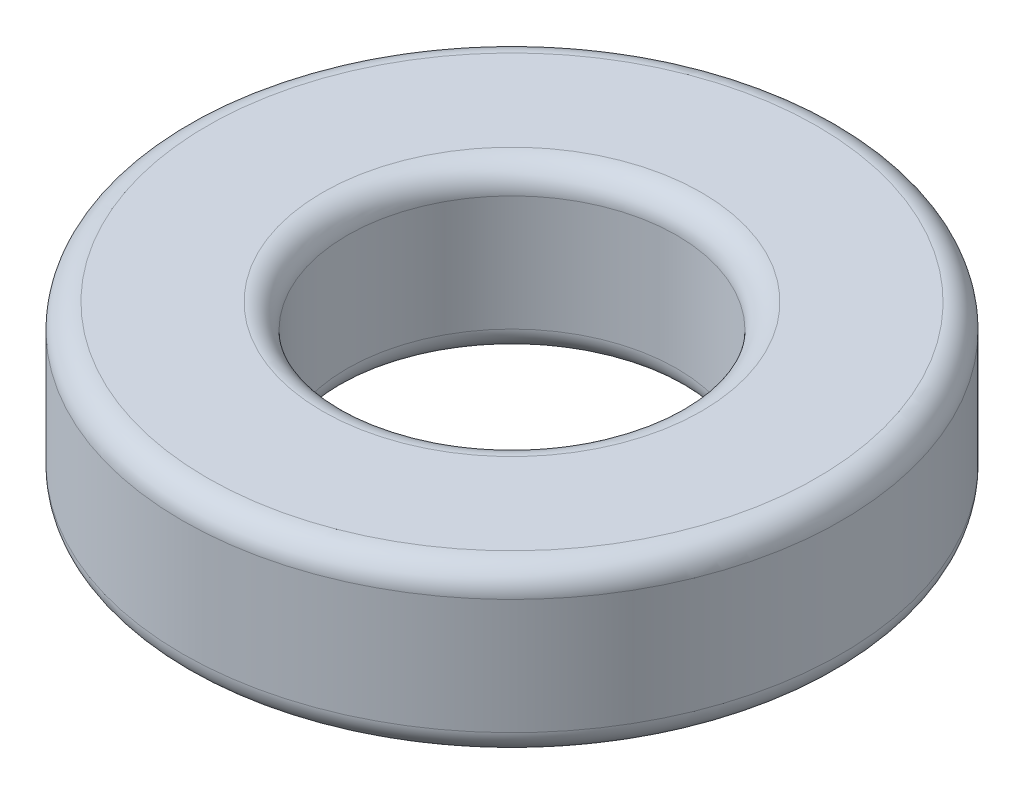
from build123d import *

# Parameters (mm, degrees)
SKETCH2_R           = 50.8
BOSS_EXTRUDE3_DEPTH = 12.7
SKETCH4_R           = 25.4
CUT_EXTRUDE1_DEPTH  = 13.97
FILLET1_R           = 3.81
FILLET2_R           = 3.81
FILLET3_R           = 3.81
FILLET4_R           = 3.81


with BuildPart() as part:
    # Sketch2 → Boss-Extrude3 (new, symmetric)
    with BuildSketch(Plane(origin=(0, 0, 0), x_dir=(1, 0, 0), z_dir=(0, 1, 0))):
        with Locations(Location((0, 0, 0), (0, 0, 270))):
            Circle(SKETCH2_R)
    extrude(amount=BOSS_EXTRUDE3_DEPTH, both=True)

    # Sketch4 → Cut-Extrude1 (cut, symmetric)
    with BuildSketch(Plane(origin=(0, 0, 0), x_dir=(1, 0, 0), z_dir=(0, 1, 0))):
        with Locations(Location((0, 0, 0), (0, 0, 270))):
            Circle(SKETCH4_R)
    extrude(amount=CUT_EXTRUDE1_DEPTH, both=True, mode=Mode.SUBTRACT)

    # Fillet1
    fillet1_edges = [part.edges().sort_by_distance(p)[0] for p in [
        (0, -12.7, -50.8),
    ]]
    fillet(fillet1_edges, radius=FILLET1_R)

    # Fillet2
    fillet2_edges = [part.edges().sort_by_distance(p)[0] for p in [
        (0, -12.7, -25.4),
    ]]
    fillet(fillet2_edges, radius=FILLET2_R)

    # Fillet3
    fillet3_edges = [part.edges().sort_by_distance(p)[0] for p in [
        (0, 12.7, -50.8),
    ]]
    fillet(fillet3_edges, radius=FILLET3_R)

    # Fillet4
    fillet4_edges = [part.edges().sort_by_distance(p)[0] for p in [
        (0, 12.7, -25.4),
    ]]
    fillet(fillet4_edges, radius=FILLET4_R)


solid = part.part
